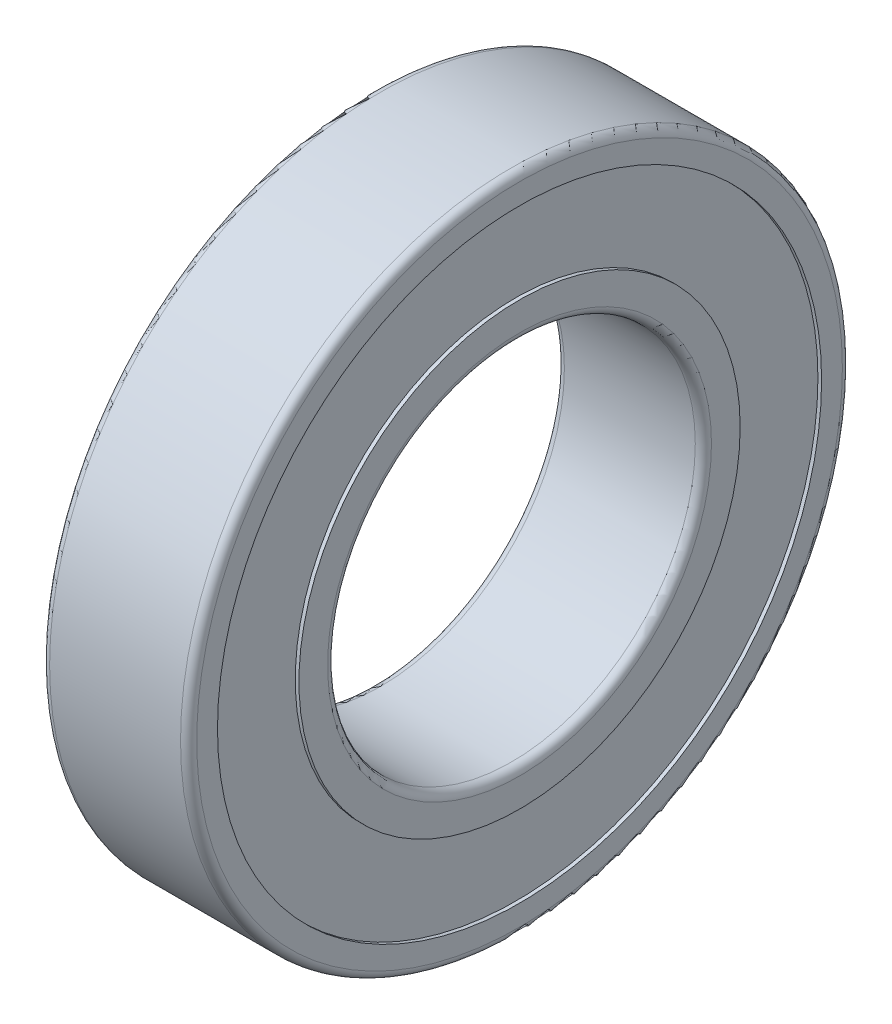
from build123d import *

# Parameters (mm, degrees)
FILLET1_R = 1.1


with BuildPart() as part:
    # Sketch1 → Revolve1 (revolve)
    with BuildSketch(Plane.XY, mode=Mode.PRIVATE) as revolve1_sk:
        Polygon((0, 25), (0, 30), (0.5, 30), (0.5, 41.075), (0, 41.075), (0, 45), (20, 45), (20, 41.075), (19.5, 41.075), (19.5, 30), (20, 30), (20, 25), align=None)
    revolve(revolve1_sk.sketch.rotate(Axis((0, 0, 0), (1, 0, 0)), 90), axis=Axis((0, 0, 0), (1, 0, 0)))

    # Fillet1
    fillet1_edges = [part.edges().sort_by_distance(p)[0] for p in [
        (20, 0, -45),
        (0, 0, -45),
        (0, 0, -25),
        (20, 0, -25),
    ]]
    fillet(fillet1_edges, radius=FILLET1_R)


solid = part.part
